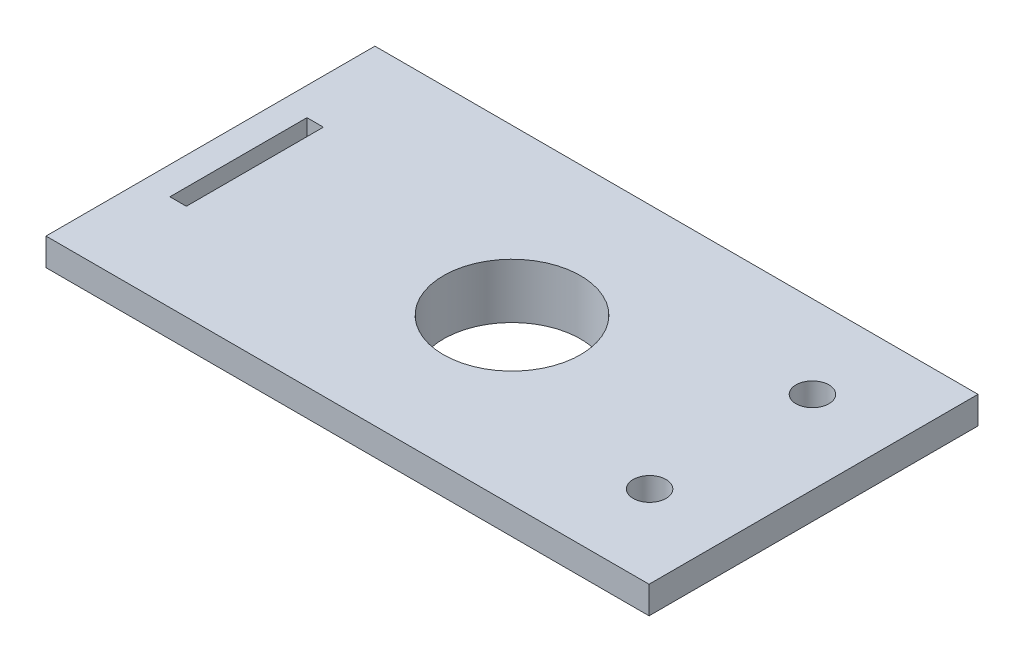
from build123d import *

# Parameters (mm, degrees)
SKETCH1_W           = 110
SKETCH1_H           = 60
BOSS_EXTRUDE1_DEPTH = 5
SKETCH2_W           = 99.8
SKETCH2_H           = 49.8
BOSS_EXTRUDE2_DEPTH = 5
SKETCH3_W           = 3
SKETCH3_H           = 25
CUT_EXTRUDE2_DEPTH  = 10
SKETCH5_R           = 3
CUT_EXTRUDE3_DEPTH  = 10
SKETCH6_R           = 12.5
CUT_EXTRUDE4_DEPTH  = 10


with BuildPart() as part:
    # Sketch1 → Boss-Extrude1 (new body)
    with BuildSketch(Plane(origin=(0, 0, 0), x_dir=(1, 0, 0), z_dir=(0, 1, 0))):
        Rectangle(SKETCH1_W, SKETCH1_H)
    extrude(amount=BOSS_EXTRUDE1_DEPTH)

    # Sketch2 → Boss-Extrude2 (add)
    with BuildSketch(Plane.XZ):
        Rectangle(SKETCH2_W, SKETCH2_H)
    extrude(amount=BOSS_EXTRUDE2_DEPTH)

    # Sketch3 → Cut-Extrude2 (cut)
    with BuildSketch(Plane.XZ.offset(5)):
        with Locations((-48.4, 0)):
            Rectangle(SKETCH3_W, SKETCH3_H)
    extrude(amount=-CUT_EXTRUDE2_DEPTH, mode=Mode.SUBTRACT)

    # Sketch5 → Cut-Extrude3 (cut)
    with BuildSketch(Plane.XZ.offset(5)):
        with Locations(Location((39.9, -14.9, 0), (0, 0, 270))):
            Circle(SKETCH5_R)
        with Locations(Location((40, 14.9, 0), (0, 0, 270))):
            Circle(SKETCH5_R)
    extrude(amount=-CUT_EXTRUDE3_DEPTH, mode=Mode.SUBTRACT)

    # Sketch6 → Cut-Extrude4 (cut)
    with BuildSketch(Plane(origin=(0, 5, 0), x_dir=(1, 0, 0), z_dir=(0, 1, 0))):
        with Locations(Location((0, 0, 0), (0, 0, 270))):
            Circle(SKETCH6_R)
    extrude(amount=-CUT_EXTRUDE4_DEPTH, mode=Mode.SUBTRACT)


solid = part.part
